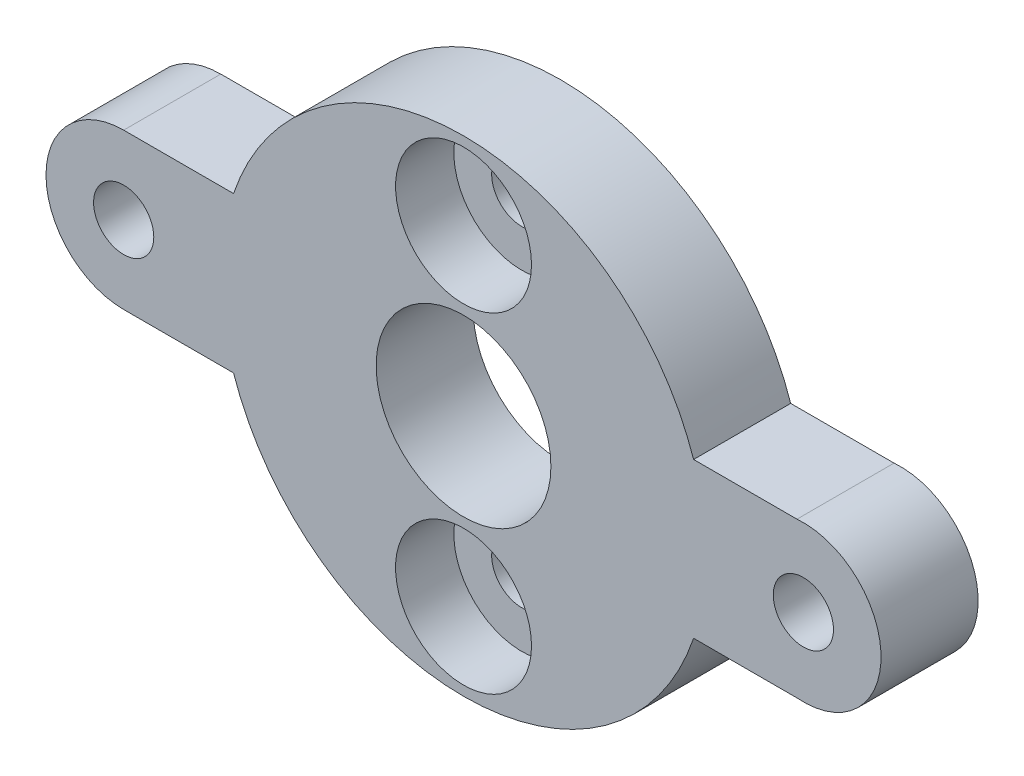
from build123d import *

# Parameters (mm, degrees)
SKETCH1_R           = 1.55
SKETCH1_R_2         = 4.5
BOSS_EXTRUDE1_DEPTH = 5
SKETCH2_R           = 3.5
CUT_EXTRUDE1_DEPTH  = 3


with BuildPart() as part:
    # Sketch1 → Boss-Extrude1 (new body)
    with BuildSketch(Plane.XY):
        with BuildLine():
            Line((-17.5, 4), (-11.842719282, 4))
            ThreePointArc((-11.842719282, 4), (0.007193328, 12.49999793), (11.847315168, 3.986367182))
            Line((11.847315168, 3.986367182), (17.170035324, 3.986367182))
            ThreePointArc((17.170035324, 3.986367182), (21.5, 0), (17.170035324, -3.986367182))
            Line((17.170035324, -3.986367182), (11.847315168, -3.986367182))
            ThreePointArc((11.847315168, -3.986367182), (0.007193328, -12.49999793), (-11.842719282, -4))
            Line((-11.842719282, -4), (-17.5, -4))
            ThreePointArc((-17.5, -4), (-21.5, 0), (-17.5, 4))
        make_face()
        with Locations((-17.5, 0)):
            Circle(SKETCH1_R, mode=Mode.SUBTRACT)
        with Locations((17.5, 0)):
            Circle(SKETCH1_R, mode=Mode.SUBTRACT)
        Circle(SKETCH1_R_2, mode=Mode.SUBTRACT)
        with Locations((0, 8.5)):
            Circle(SKETCH1_R, mode=Mode.SUBTRACT)
        with Locations((0, -8.5)):
            Circle(SKETCH1_R, mode=Mode.SUBTRACT)
    extrude(amount=BOSS_EXTRUDE1_DEPTH)

    # Sketch2 → Cut-Extrude1 (cut)
    with BuildSketch(Plane.XY.offset(5)):
        with Locations((0, 8.5)):
            Circle(SKETCH2_R)
        with Locations((0, -8.5)):
            Circle(SKETCH2_R)
    extrude(amount=-CUT_EXTRUDE1_DEPTH, mode=Mode.SUBTRACT)


solid = part.part
